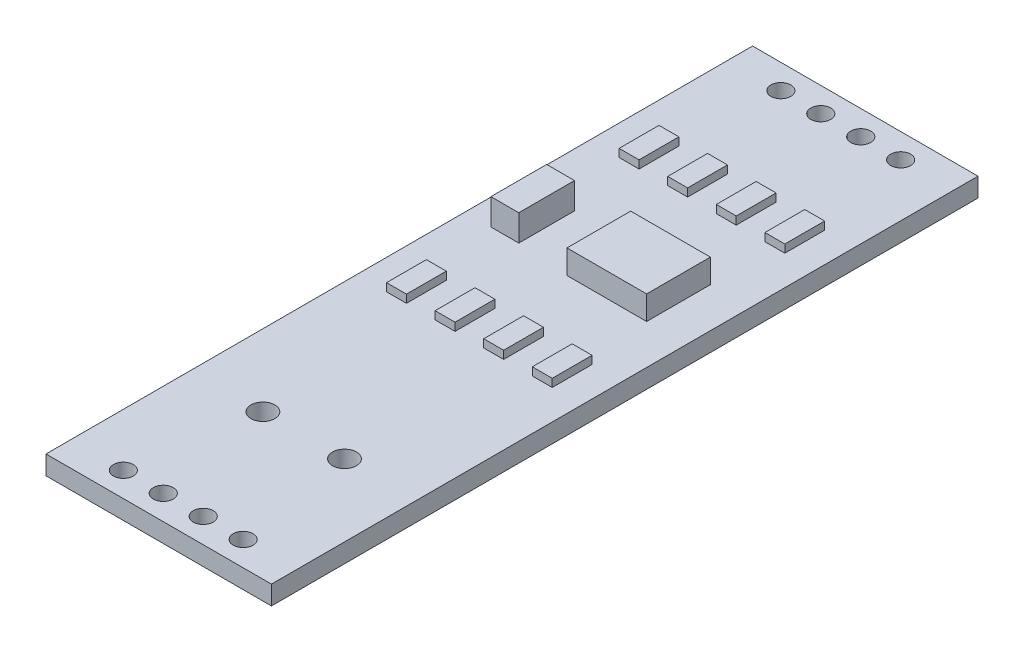
from build123d import *

# Parameters (mm, degrees)
SKETCH1_W           = 14.15
SKETCH1_H           = 44.35
BOSS_EXTRUDE1_DEPTH = 1.19
SKETCH2_R           = 0.625
CUT_EXTRUDE1_DEPTH  = 24.306701826
SKETCH3_R           = 0.75
CUT_EXTRUDE2_DEPTH  = 24.306701826
SKETCH4_W           = 5
SKETCH4_H           = 4
BOSS_EXTRUDE2_DEPTH = 1.5
SKETCH4_3_W         = 1.75
SKETCH4_3_H         = 3.5
BOSS_EXTRUDE3_DEPTH = 1.65
SKETCH7_W           = 1.25
SKETCH7_H           = 2.5
BOSS_EXTRUDE6_DEPTH = 0.5


with BuildPart() as part:
    # Sketch1 → Boss-Extrude1 (new body)
    with BuildSketch(Plane(origin=(0, 0, 0), x_dir=(1, 0, 0), z_dir=(0, 1, 0))):
        Rectangle(SKETCH1_W, SKETCH1_H)
    extrude(amount=BOSS_EXTRUDE1_DEPTH)

    # Sketch2 → Cut-Extrude1 (cut, through all)
    with BuildSketch(Plane(origin=(0, 1.19, 0), x_dir=(1, 0, 0), z_dir=(0, 1, 0))):
        with Locations((3.76, -20.635)):
            Circle(SKETCH2_R)
        with Locations((1.253333333, -20.635)):
            Circle(SKETCH2_R)
        with Locations((-1.253333333, -20.635)):
            Circle(SKETCH2_R)
        with Locations((-3.76, -20.635)):
            Circle(SKETCH2_R)
    cut_extrude1 = extrude(amount=-CUT_EXTRUDE1_DEPTH, mode=Mode.SUBTRACT)

    # Mirror1: Cut-Extrude1 across plane
    add(cut_extrude1.mirror(Plane.XY), mode=Mode.SUBTRACT)

    # Sketch3 → Cut-Extrude2 (cut, through all)
    with BuildSketch(Plane(origin=(0, 1.19, 0), x_dir=(1, 0, 0), z_dir=(0, 1, 0))):
        with Locations((2.56, -13.075)):
            Circle(SKETCH3_R)
        with Locations((-2.56, -13.075)):
            Circle(SKETCH3_R)
    extrude(amount=-CUT_EXTRUDE2_DEPTH, mode=Mode.SUBTRACT)

    # Sketch4 → Boss-Extrude2 (add)
    with BuildSketch(Plane(origin=(0, 1.19, 0), x_dir=(1, 0, 0), z_dir=(0, 1, 0))):
        with Locations((2.075, 5.875)):
            Rectangle(SKETCH4_W, SKETCH4_H)
    extrude(amount=BOSS_EXTRUDE2_DEPTH)

    # Sketch4<3> → Boss-Extrude3 (add)
    with BuildSketch(Plane(origin=(0, 1.19, 0), x_dir=(1, 0, 0), z_dir=(0, 1, 0))):
        with Locations((-4.575, 5.875)):
            Rectangle(SKETCH4_3_W, SKETCH4_3_H)
    extrude(amount=BOSS_EXTRUDE3_DEPTH)

    # Sketch7 → Boss-Extrude6 (add)
    with BuildSketch(Plane(origin=(0, 1.19, 0), x_dir=(1, 0, 0), z_dir=(0, 1, 0))):
        with Locations((-4.575, -1.425)):
            Rectangle(SKETCH7_W, SKETCH7_H)
        with Locations((-1.525, -1.425)):
            Rectangle(SKETCH7_W, SKETCH7_H)
        with Locations((1.525, -1.425)):
            Rectangle(SKETCH7_W, SKETCH7_H)
        with Locations((4.575, -1.425)):
            Rectangle(SKETCH7_W, SKETCH7_H)
    boss_extrude6 = extrude(amount=BOSS_EXTRUDE6_DEPTH)

    # Mirror2: Boss-Extrude6 across plane
    add(boss_extrude6.mirror(Plane.XY.offset(-5.875)))


solid = part.part
